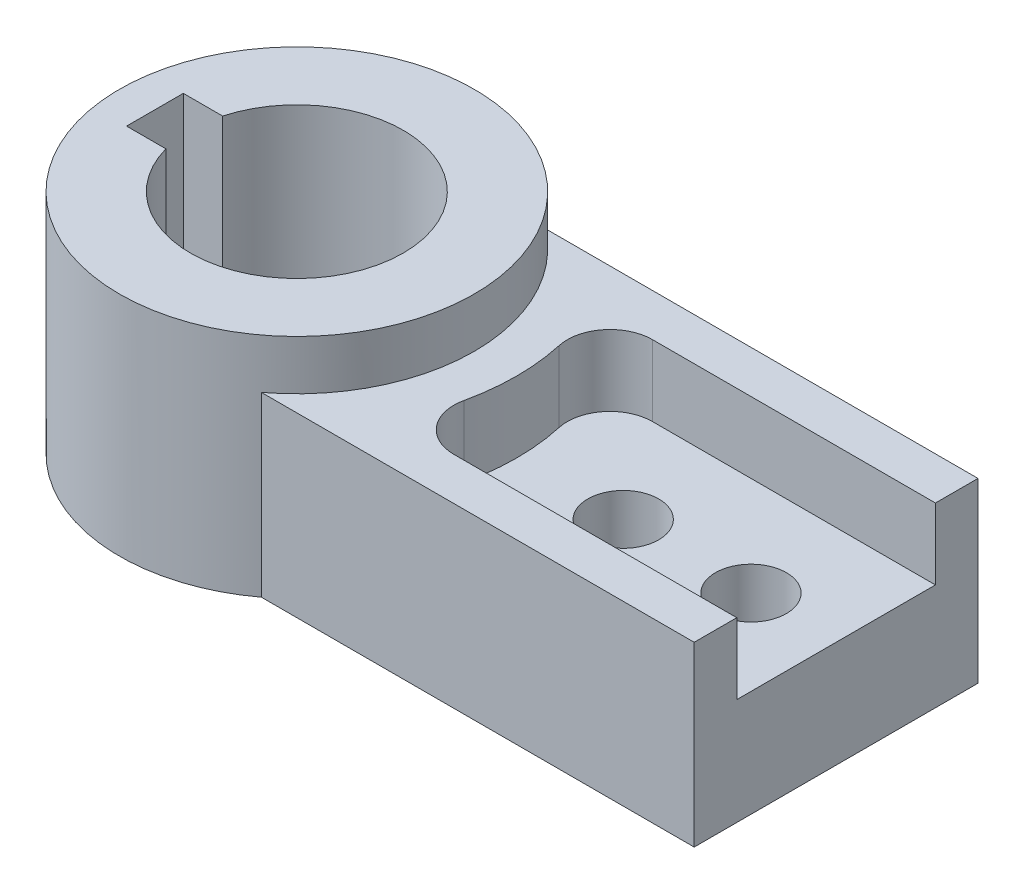
from build123d import *

# Parameters (mm, degrees)
EXTRUDE_1_DEPTH = 32
EXTRUDE_2_DEPTH = 25
EXTRUDE_3_DEPTH = 15


with BuildPart() as part:
    # 草图1 → 凸台-拉伸1 (new body)
    with BuildSketch(Plane(origin=(0, 0, 0), x_dir=(1, 0, 0), z_dir=(0, 1, 0))):
        with BuildLine():
            ThreePointArc((15, -20), (22.360679775, -11.180339887), (25, 0))
            ThreePointArc((25, 0), (22.360679775, 11.180339887), (15, 20))
            ThreePointArc((15, 20), (-25, 0), (15, -20))
        make_face()
        with BuildLine():
            Line((-20, 0), (-20, 4))
            Line((-20, 4), (-14.456832295, 4))
            ThreePointArc((-14.456832295, 4), (15, 0), (-14.456832295, -4))
            Line((-14.456832295, -4), (-20, -4))
            Line((-20, -4), (-20, 0))
        make_face(mode=Mode.SUBTRACT)
    extrude(amount=EXTRUDE_1_DEPTH)

    # 草图1<3> → 凸台-拉伸2 (add)
    with BuildSketch(Plane(origin=(0, 0, 0), x_dir=(1, 0, 0), z_dir=(0, 1, 0))):
        with BuildLine():
            ThreePointArc((15, 20), (25, 0), (15, -20))
            Line((15, -20), (76, -20))
            Line((76, -20), (76, -14))
            Line((76, -14), (36.124783736, -14))
            ThreePointArc((36.124783736, -14), (31.445906532, -11.756076158), (30.266710698, -6.702702703))
            ThreePointArc((30.266710698, -6.702702703), (31, 0), (30.266710698, 6.702702703))
            ThreePointArc((30.266710698, 6.702702703), (31.445906532, 11.756076158), (36.124783736, 14))
            Line((36.124783736, 14), (76, 14))
            Line((76, 14), (76, 20))
            Line((76, 20), (15, 20))
        make_face()
    extrude(amount=EXTRUDE_2_DEPTH)

    # 草图1<4> → 凸台-拉伸3 (add)
    with BuildSketch(Plane(origin=(0, 0, 0), x_dir=(1, 0, 0), z_dir=(0, 1, 0))):
        with BuildLine():
            ThreePointArc((30.266710698, 6.702702703), (30.816132396, 3.371347532), (31, 0))
            ThreePointArc((31, 0), (30.816132396, -3.371347532), (30.266710698, -6.702702703))
            ThreePointArc((30.266710698, -6.702702703), (31.445906532, -11.756076158), (36.124783736, -14))
            Line((36.124783736, -14), (76, -14))
            Line((76, -14), (76, 0))
            Line((76, 0), (76, 14))
            Line((76, 14), (36.124783736, 14))
            ThreePointArc((36.124783736, 14), (31.445906532, 11.756076158), (30.266710698, 6.702702703))
        make_face()
        with BuildLine():
            ThreePointArc((41, 0), (46, 5), (51, 0))
            ThreePointArc((51, 0), (46, -5), (41, 0))
        make_face(mode=Mode.SUBTRACT)
        with BuildLine():
            ThreePointArc((59, 0), (64, 5), (69, 0))
            ThreePointArc((69, 0), (64, -5), (59, 0))
        make_face(mode=Mode.SUBTRACT)
    extrude(amount=EXTRUDE_3_DEPTH)


solid = part.part
